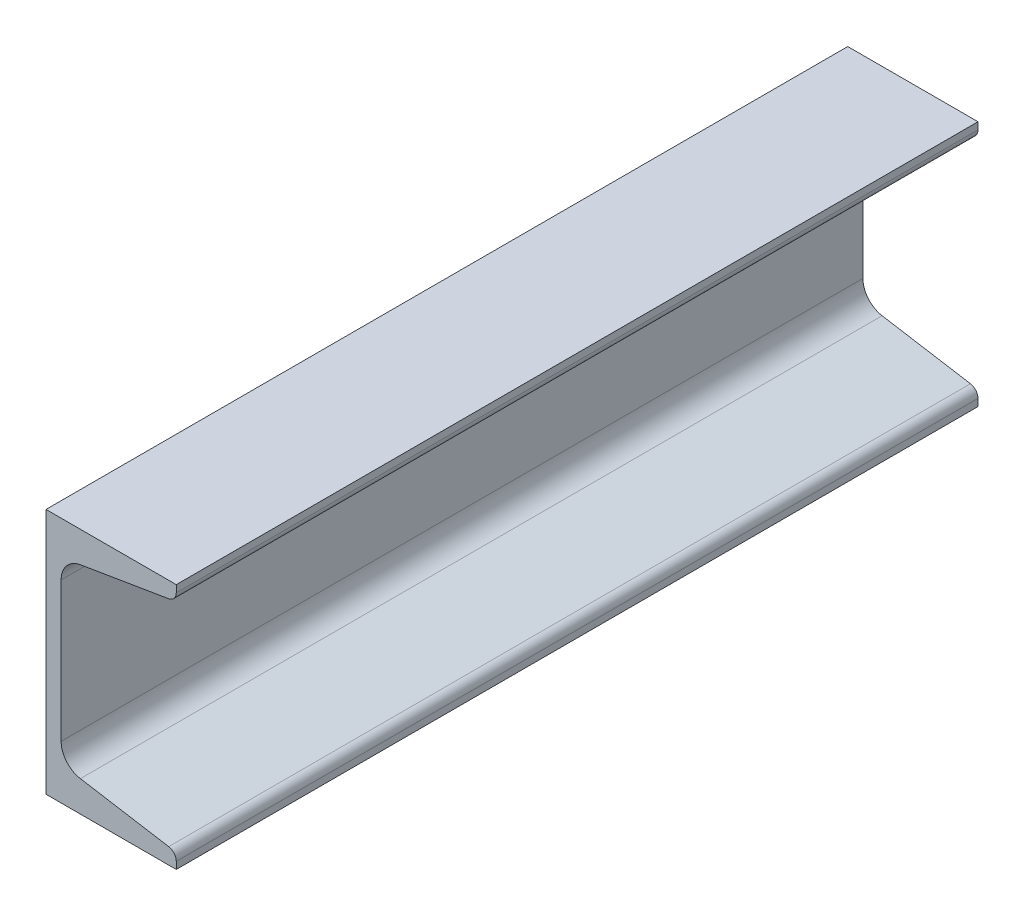
from build123d import *

# Parameters (mm, degrees)
BOSS_EXTRUDE1_DEPTH = 247.65


with BuildPart() as part:
    # Sketch1 → Boss-Extrude1 (new body)
    with BuildSketch(Plane.XY):
        with BuildLine():
            Line((0, 0), (0, 76.2))
            Line((0, 76.2), (40.2336, 76.2))
            Line((40.2336, 76.2), (40.2336, 74.011994208))
            ThreePointArc((40.2336, 74.011994208), (39.571488513, 72.206035358), (37.898963373, 71.256015019))
            Line((37.898963373, 71.256015019), (10.616311414, 66.708574647))
            ThreePointArc((10.616311414, 66.708574647), (6.358974694, 64.290341057), (4.6736, 59.693354893))
            Line((4.6736, 59.693354893), (4.6736, 16.506645107))
            ThreePointArc((4.6736, 16.506645107), (6.358974694, 11.909658943), (10.616311414, 9.491425353))
            Line((10.616311414, 9.491425353), (37.898963373, 4.943984981))
            ThreePointArc((37.898963373, 4.943984981), (39.571488513, 3.993964642), (40.2336, 2.188005792))
            Line((40.2336, 2.188005792), (40.2336, 0))
            Line((40.2336, 0), (0, 0))
        make_face()
    extrude(amount=BOSS_EXTRUDE1_DEPTH)


solid = part.part
